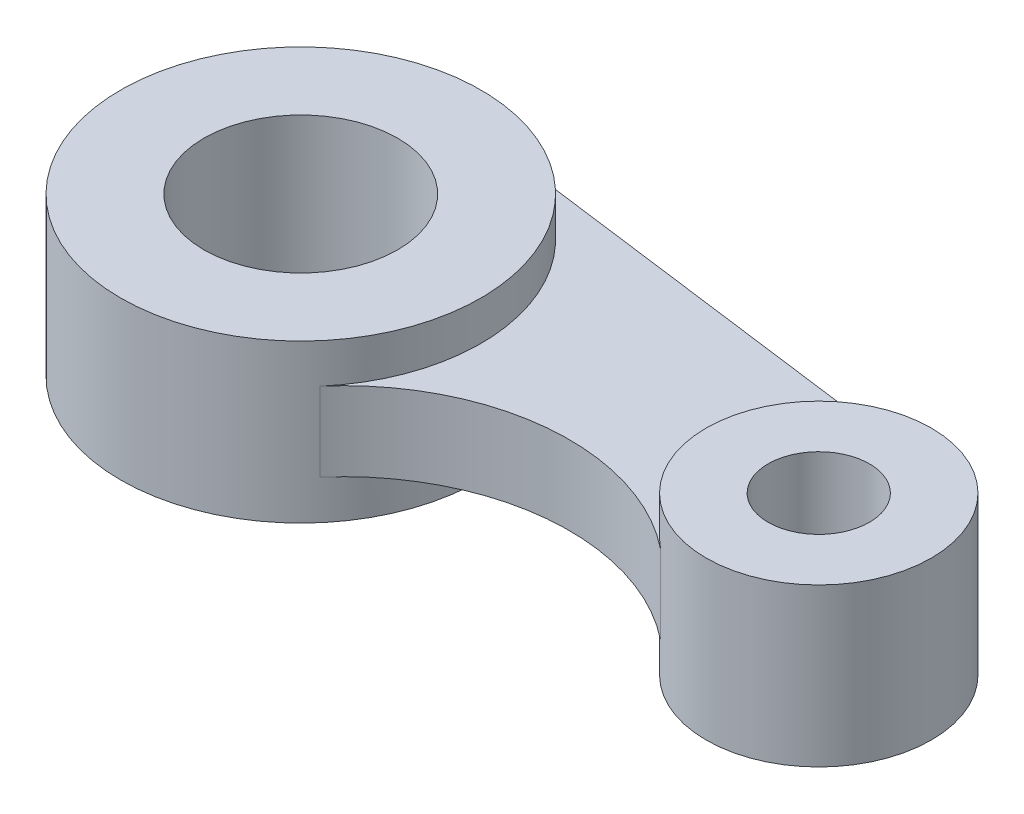
from build123d import *

# Parameters (mm, degrees)
SKETCH_1_R        = 80
SKETCH_1_R_2      = 43
EXTRUDE_1_DEPTH   = 70
SKETCH_1_R_3      = 50
SKETCH_1_R_4      = 22.5
EXTRUDE_1_2_DEPTH = 70
EXTRUDE_START     = -52.5
EXTRUDE_2_DEPTH   = 35


with BuildPart() as part:
    # 스케치1 → 보스-돌출1 (new body)
    with BuildSketch(Plane(origin=(0, 0, 0), x_dir=(1, 0, 0), z_dir=(0, 1, 0))):
        with Locations(Location((-122.899042893, 0, 0), (0, 0, 270))):
            Circle(SKETCH_1_R)
        with Locations(Location((-122.899042893, 0, 0), (0, 0, 270))):
            Circle(SKETCH_1_R_2, mode=Mode.SUBTRACT)
    extrude(amount=EXTRUDE_1_DEPTH)



with BuildPart() as body_2:
    # 스케치1 → Extrude 1 2 (new body)
    with BuildSketch(Plane(origin=(0, 0, 0), x_dir=(1, 0, 0), z_dir=(0, 1, 0))):
        with Locations(Location((107.100957107, 0, 0), (0, 0, 270))):
            Circle(SKETCH_1_R_3)
        with Locations(Location((107.100957107, 0, 0), (0, 0, 270))):
            Circle(SKETCH_1_R_4, mode=Mode.SUBTRACT)
    extrude(amount=EXTRUDE_1_2_DEPTH)


with BuildPart() as part_1:
    add(part.part)

    add(body_2.part)  # 보스-돌출2 merges body 2
    # 스케치2 → 보스-돌출2 (add)
    with BuildSketch(Plane(origin=(0, 70, 0), x_dir=(1, 0, 0), z_dir=(0, 1, 0)).offset(EXTRUDE_START)):
        with BuildLine():
            Line((-112.464260284, 79.316551311), (113.622696237, 49.57284457))
            ThreePointArc((113.622696237, 49.57284457), (61.083229888, 19.554252264), (75.941536817, -39.10358714))
            ThreePointArc((75.941536817, -39.10358714), (4.230318414, -17.752822315), (-62.222714391, -52.138116186))
            ThreePointArc((-62.222714391, -52.138116186), (-48.171003091, 28.560813493), (-112.464260284, 79.316551311))
        make_face()
    extrude(amount=EXTRUDE_2_DEPTH)


solid = part_1.part
